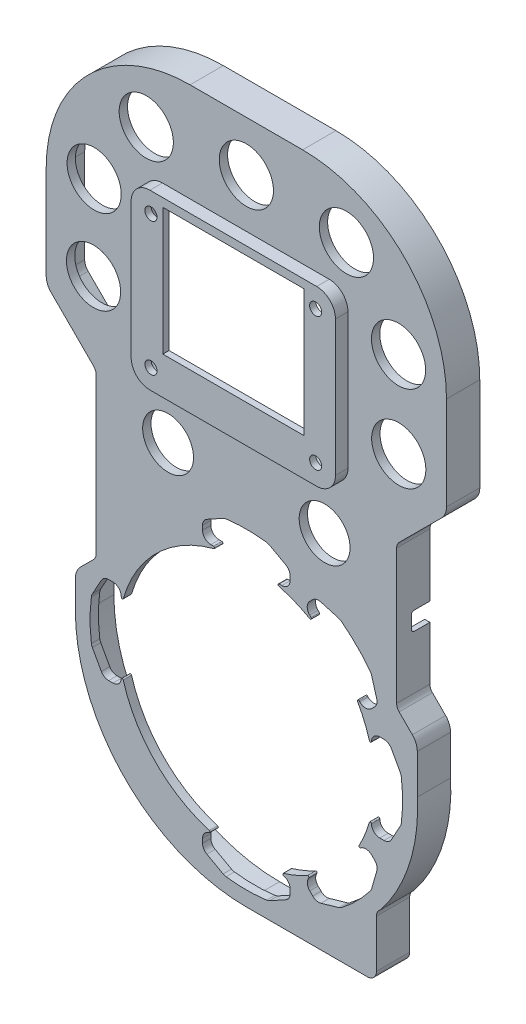
from build123d import *

# Parameters (mm, degrees)
SKETCH1_R           = 6.1
SKETCH1_R_2         = 6.5
BOSS_EXTRUDE1_DEPTH = 2
BOSS_EXTRUDE2_DEPTH = 3
CUT_EXTRUDE1_DEPTH  = 133.131994752
CUT_EXTRUDE2_DEPTH  = 3.5
CUT_EXTRUDE5_DEPTH  = 133.083738731
BOSS_EXTRUDE4_START = 5.980000305
BOSS_EXTRUDE4_DEPTH = 5.980000305
CUT_EXTRUDE4_DEPTH  = 150.092222015
FILLET1_R           = 0.25


with BuildPart() as part:
    # Sketch1 → Boss-Extrude1 (new body)
    with BuildSketch(Plane.XY):
        with BuildLine():
            Line((-40.99900221, 6.798147106), (-41.00000222, -0.001023127))
            ThreePointArc((-41.00000222, -0.001023127), (-28.991100816, -28.992114941), (-2.221e-06, -41.000999974))
            Line((-2.221e-06, -41.000999974), (28.998984813, -41.000999974))
            ThreePointArc((28.998984813, -41.000999974), (30.55486713, -40.352346624), (31.199998433, -38.795000627))
            Line((31.199998433, -38.795000627), (31.199998433, -27.309616105))
            ThreePointArc((31.199998433, -27.309616105), (31.357117283, -26.519106398), (31.805105376, -25.849107444))
            Line((31.805105376, -25.849107444), (32.299600467, -25.354612354))
            ThreePointArc((32.299600467, -25.354612354), (39.176448081, -12.31709696), (40.998998595, 2.309801221))
            Line((40.998998595, 2.309801221), (40.998998595, 11.797614815))
            ThreePointArc((40.998998595, 11.797614815), (40.689786117, 13.35390515), (39.808105495, 14.673106136))
            Line((39.808105495, 14.673106136), (36.642912795, 17.838297914))
            ThreePointArc((36.642912795, 17.838297914), (36.195116033, 18.509108816), (36.036999523, 19.299999691))
            Line((36.036999523, 19.299999691), (36.036999523, 51.57023147))
            ThreePointArc((36.036999523, 51.57023147), (36.201953979, 52.364087426), (36.652447097, 53.038233702))
            Line((36.652447097, 53.038233702), (46.818470061, 63.204256854))
            ThreePointArc((46.818470061, 63.204256854), (47.699388674, 64.523546607), (48.008999543, 66.079401409))
            Line((48.008999543, 66.079401409), (47.999999624, 88.500007865))
            ThreePointArc((47.999999624, 88.500007865), (37.895106405, 112.895106781), (13.500007489, 123))
            Line((13.500007489, 123), (-13.500000376, 123))
            ThreePointArc((-13.500000376, 123), (-37.895104377, 112.895109562), (-48.000000376, 88.500007865))
            Line((-48.000000376, 88.500007865), (-48.000000376, 66.070384522))
            ThreePointArc((-48.000000376, 66.070384522), (-47.690787898, 64.514094187), (-46.809107276, 63.1948932))
            Line((-46.809107276, 63.1948932), (-36.642914576, 53.028701423))
            ThreePointArc((-36.642914576, 53.028701423), (-36.195117814, 52.35789052), (-36.037001304, 51.566999646))
            Line((-36.037001304, 51.566999646), (-36.037000665, 14.301130179))
            ThreePointArc((-36.037000665, 14.301130179), (-36.194683873, 13.510158706), (-36.642108911, 12.839106769))
            Line((-36.642108911, 12.839106769), (-39.807845317, 9.673370264))
            ThreePointArc((-39.807845317, 9.673370264), (-40.68961653, 8.354323564), (-40.99900221, 6.798147106))
        make_face()
        with Locations((-18.767998896, 45.999999683)):
            Circle(SKETCH1_R, mode=Mode.SUBTRACT)
        with Locations((18.767988791, 45.999994761)):
            Circle(SKETCH1_R, mode=Mode.SUBTRACT)
        with Locations((36.549952387, 71.35011767)):
            Circle(SKETCH1_R_2, mode=Mode.SUBTRACT)
        with Locations((36.499964594, 92.000126825)):
            Circle(SKETCH1_R_2, mode=Mode.SUBTRACT)
        with Locations((23.9998883, 109.00006579)):
            Circle(SKETCH1_R_2, mode=Mode.SUBTRACT)
        with Locations((0.000117182, 111.000035272)):
            Circle(SKETCH1_R_2, mode=Mode.SUBTRACT)
        with Locations((-24.000058294, 108.999882684)):
            Circle(SKETCH1_R_2, mode=Mode.SUBTRACT)
        with Locations((-36.499959112, 91.999882684)):
            Circle(SKETCH1_R_2, mode=Mode.SUBTRACT)
        with Locations((-36.649960638, 71.649876581)):
            Circle(SKETCH1_R_2, mode=Mode.SUBTRACT)
        with BuildLine():
            Line((8.498217528, -29.999989932), (7.320711296, -29.999989932))
            ThreePointArc((7.320711296, -29.999989932), (11.855484749, -28.504033505), (16.103422547, -26.322960291))
            Line((16.103422547, -26.322960291), (15.206897602, -27.219485237))
            ThreePointArc((15.206897602, -27.219485237), (14.621111164, -28.633698799), (15.206897602, -30.047912361))
            Line((15.206897602, -30.047912361), (15.928049055, -30.769063814))
            ThreePointArc((15.928049055, -30.769063814), (16.84292629, -31.291513163), (17.896363573, -31.276560982))
            Line((17.896363573, -31.276560982), (22.183094016, -30.040536539))
            ThreePointArc((22.183094016, -30.040536539), (22.53156957, -29.903582275), (22.848411695, -29.704076008))
            ThreePointArc((22.848411695, -29.704076008), (26.504829459, -26.492827623), (29.714297788, -22.834847291))
            ThreePointArc((29.714297788, -22.834847291), (29.91343032, -22.518342524), (30.050164983, -22.17030134))
            Line((30.050164983, -22.17030134), (31.284907406, -17.888017149))
            ThreePointArc((31.284907406, -17.888017149), (31.299859587, -16.834579866), (30.777410238, -15.919702631))
            Line((30.777410238, -15.919702631), (30.056258785, -15.198551178))
            ThreePointArc((30.056258785, -15.198551178), (28.642045223, -14.612764741), (27.22783166, -15.198551178))
            Line((27.22783166, -15.198551178), (26.136786034, -16.289596804))
            ThreePointArc((26.136786034, -16.289596804), (28.474385236, -11.660635441), (29.999524405, -6.704265414))
            Line((29.999524405, -6.704265414), (29.999524405, -8.679270824))
            ThreePointArc((29.999524405, -8.679270824), (30.585310842, -10.093484386), (31.999524405, -10.679270824))
            Line((31.999524405, -10.679270824), (33.01938657, -10.679270824))
            ThreePointArc((33.01938657, -10.679270824), (34.035729944, -10.401782404), (34.770049802, -9.646316969))
            Line((34.770049802, -9.646316969), (36.927224702, -5.741139538))
            ThreePointArc((36.927224702, -5.741139538), (37.076792841, -5.397888822), (37.159761821, -5.032775373))
            ThreePointArc((37.159761821, -5.032775373), (37.474544109, -0.176602068), (37.157398229, 4.67941745))
            ThreePointArc((37.157398229, 4.67941745), (37.074403526, 5.044028081), (36.924987253, 5.386816369))
            Line((36.924987253, 5.386816369), (34.770049802, 9.2879433))
            ThreePointArc((34.770049802, 9.2879433), (34.035729944, 10.043408735), (33.01938657, 10.320897154))
            Line((33.01938657, 10.320897154), (31.999524405, 10.320897154))
            ThreePointArc((31.999524405, 10.320897154), (30.585310842, 9.735110716), (29.999524405, 8.320897154))
            Line((29.999524405, 8.320897154), (29.999524405, 6.332821196))
            ThreePointArc((29.999524405, 6.332821196), (28.260277654, 11.806823537), (25.53182947, 16.861054577))
            Line((25.53182947, 16.861054577), (27.202639399, 15.190244647))
            ThreePointArc((27.202639399, 15.190244647), (28.616852962, 14.60445821), (30.031066524, 15.190244647))
            Line((30.031066524, 15.190244647), (30.752217977, 15.9113961))
            ThreePointArc((30.752217977, 15.9113961), (31.274667326, 16.826273335), (31.259715145, 17.879710618))
            Line((31.259715145, 17.879710618), (30.023690702, 22.166441061))
            ThreePointArc((30.023690702, 22.166441061), (29.886736438, 22.514916616), (29.687230171, 22.83175874))
            ThreePointArc((29.687230171, 22.83175874), (26.475981786, 26.488176505), (22.818001454, 29.697644834))
            ThreePointArc((22.818001454, 29.697644834), (22.501496686, 29.896777366), (22.153455503, 30.033512029))
            Line((22.153455503, 30.033512029), (17.871171312, 31.268254451))
            ThreePointArc((17.871171312, 31.268254451), (16.817734029, 31.283206632), (15.902856794, 30.760757283))
            Line((15.902856794, 30.760757283), (15.181705341, 30.03960583))
            ThreePointArc((15.181705341, 30.03960583), (14.595918903, 28.625392268), (15.181705341, 27.211178706))
            Line((15.181705341, 27.211178706), (17.046324537, 25.346559509))
            ThreePointArc((17.046324537, 25.346559509), (11.557478813, 28.255519634), (5.59540313, 29.999976553))
            Line((5.59540313, 29.999976553), (8.493548338, 29.999976553))
            ThreePointArc((8.493548338, 29.999976553), (9.907761901, 30.585762991), (10.493548338, 31.999976553))
            Line((10.493548338, 31.999976553), (10.493548338, 33.019838718))
            ThreePointArc((10.493548338, 33.019838718), (10.216059919, 34.036182092), (9.460594484, 34.77050195))
            Line((9.460594484, 34.77050195), (5.555417053, 36.92767685))
            ThreePointArc((5.555417053, 36.92767685), (5.212166337, 37.077244989), (4.847052888, 37.16021397))
            ThreePointArc((4.847052888, 37.16021397), (-0.009120418, 37.474996257), (-4.865139935, 37.157850378))
            ThreePointArc((-4.865139935, 37.157850378), (-5.229750566, 37.074855674), (-5.572538855, 36.925439401))
            Line((-5.572538855, 36.925439401), (-9.473665785, 34.77050195))
            ThreePointArc((-9.473665785, 34.77050195), (-10.22913122, 34.036182092), (-10.506619639, 33.019838718))
            Line((-10.506619639, 33.019838718), (-10.506619639, 31.999976553))
            ThreePointArc((-10.506619639, 31.999976553), (-9.920833202, 30.585762991), (-8.506619639, 29.999976553))
            Line((-8.506619639, 29.999976553), (-5.596307426, 29.999976553))
            ThreePointArc((-5.596307426, 29.999976553), (-21.37256636, 21.853396161), (-29.999984316, 6.33486603))
            Line((-29.999984316, 6.33486603), (-29.999984316, 8.499295286))
            ThreePointArc((-29.999984316, 8.499295286), (-30.585770754, 9.913508849), (-31.999984316, 10.499295286))
            Line((-31.999984316, 10.499295286), (-33.019846482, 10.499295286))
            ThreePointArc((-33.019846482, 10.499295286), (-34.036189856, 10.221806867), (-34.770509714, 9.466341432))
            Line((-34.770509714, 9.466341432), (-36.927684614, 5.561164001))
            ThreePointArc((-36.927684614, 5.561164001), (-37.077252753, 5.217913285), (-37.160221733, 4.852799836))
            ThreePointArc((-37.160221733, 4.852799836), (-37.47500402, -0.00337347), (-37.157858141, -4.859392987))
            ThreePointArc((-37.157858141, -4.859392987), (-37.074863438, -5.224003618), (-36.925447164, -5.566791907))
            Line((-36.925447164, -5.566791907), (-34.770509714, -9.467918837))
            ThreePointArc((-34.770509714, -9.467918837), (-34.036189856, -10.223384272), (-33.019846482, -10.500872691))
            Line((-33.019846482, -10.500872691), (-31.999984316, -10.500872691))
            ThreePointArc((-31.999984316, -10.500872691), (-30.585770754, -9.915086254), (-29.999984316, -8.500872691))
            Line((-29.999984316, -8.500872691), (-29.999984316, -6.706310248))
            ThreePointArc((-29.999984316, -6.706310248), (-21.997212331, -21.601429929), (-7.321615592, -29.999989932))
            Line((-7.321615592, -29.999989932), (-8.50195045, -29.999989932))
            ThreePointArc((-8.50195045, -29.999989932), (-9.916164012, -30.58577637), (-10.50195045, -31.999989932))
            Line((-10.50195045, -31.999989932), (-10.50195045, -33.019852097))
            ThreePointArc((-10.50195045, -33.019852097), (-10.224462031, -34.036195472), (-9.468996596, -34.770515329))
            Line((-9.468996596, -34.770515329), (-5.563819165, -36.92769023))
            ThreePointArc((-5.563819165, -36.92769023), (-5.220568448, -37.077258368), (-4.855454999, -37.160227349))
            ThreePointArc((-4.855454999, -37.160227349), (0.000718306, -37.475009636), (4.856737824, -37.157863757))
            ThreePointArc((4.856737824, -37.157863757), (5.221348455, -37.074869053), (5.564136743, -36.92545278))
            Line((5.564136743, -36.92545278), (9.465263674, -34.770515329))
            ThreePointArc((9.465263674, -34.770515329), (10.220729109, -34.036195472), (10.498217528, -33.019852097))
            Line((10.498217528, -33.019852097), (10.498217528, -31.999989932))
            ThreePointArc((10.498217528, -31.999989932), (9.91243109, -30.58577637), (8.498217528, -29.999989932))
        make_face(mode=Mode.SUBTRACT)
    extrude(amount=BOSS_EXTRUDE1_DEPTH)

    # Sketch3 → Boss-Extrude2 (add)
    with BuildSketch(Plane.XY.offset(2)):
        with BuildLine():
            Line((-17.027010773, 99.303991329), (-20.127010773, 99.303990787))
            ThreePointArc((-20.127010773, 99.303990787), (-23.308991058, 97.985970746), (-24.627009986, 94.803990001))
            Line((-24.627009986, 94.803990001), (-24.627004304, 62.303990001))
            ThreePointArc((-24.627004304, 62.303990001), (-23.308984263, 59.122009716), (-20.127003517, 57.803990787))
            Line((-20.127003517, 57.803990787), (-17.027003517, 57.803991329))
            Line((-17.027003517, 57.803991329), (16.772996424, 57.803997239))
            Line((16.772996424, 57.803997239), (19.872996483, 57.803997781))
            ThreePointArc((19.872996483, 57.803997781), (23.054976768, 59.122017822), (24.372995696, 62.303998568))
            Line((24.372995696, 62.303998568), (24.372990014, 94.803998568))
            ThreePointArc((24.372990014, 94.803998568), (23.054969973, 97.985978853), (19.872989227, 99.303997781))
            Line((19.872989227, 99.303997781), (16.772989155, 99.303997239))
            Line((16.772989155, 99.303997239), (-17.027010773, 99.303991329))
        make_face()
    extrude(amount=BOSS_EXTRUDE2_DEPTH)

    # Sketch4 → Cut-Extrude1 (cut, through all)
    with BuildSketch(Plane.XY.offset(5)):
        Polygon((-17.027005163, 66.803991329), (16.772994837, 66.803997239), (16.772989505, 97.303997239), (-17.027010495, 97.303991329), align=None)
    extrude(amount=-CUT_EXTRUDE1_DEPTH, mode=Mode.SUBTRACT)

    # Sketch5 → Cut-Extrude2 (cut)
    with BuildSketch(Plane.XY):
        with BuildLine():
            Line((-22.877009986, 94.803990307), (-22.877004304, 62.303990307))
            ThreePointArc((-22.877004304, 62.303990307), (-22.071547612, 60.359446799), (-20.127003823, 59.553990787))
            Line((-20.127003823, 59.553990787), (-17.027003823, 59.553991329))
            Line((-17.027003823, 59.553991329), (16.772996118, 59.553997239))
            Line((16.772996118, 59.553997239), (19.872996177, 59.553997781))
            ThreePointArc((19.872996177, 59.553997781), (21.817539685, 60.359454473), (22.622995696, 62.303998262))
            Line((22.622995696, 62.303998262), (22.622990014, 94.803998262))
            ThreePointArc((22.622990014, 94.803998262), (21.817533322, 96.748541769), (19.872989533, 97.553997781))
            Line((19.872989533, 97.553997781), (16.772989461, 97.553997239))
            Line((16.772989461, 97.553997239), (-17.027010539, 97.553991329))
            Line((-17.027010539, 97.553991329), (-20.127010467, 97.553990787))
            ThreePointArc((-20.127010467, 97.553990787), (-22.071553974, 96.748534096), (-22.877009986, 94.803990307))
        make_face()
    extrude(amount=CUT_EXTRUDE2_DEPTH, mode=Mode.SUBTRACT)

    # Sketch8 → Cut-Extrude5 (cut, through all)
    with BuildSketch(Plane(origin=(0, 0, 3.5), x_dir=(-1, 0, 0), z_dir=(0, 0, -1))):
        with BuildLine():
            add(Edge.make_bspline(
                [(21.327009938, 94.528990578), (21.327010445, 97.428990578), (18.427010445, 97.428991085), (18.427009938, 94.528991085), (18.427009431, 91.628991085), (21.327009431, 91.628990578), (21.327009938, 94.528990578)],
                knots=[0, 0, 0, 0, 0.5, 0.5, 0.5, 1, 1, 1, 1], degree=3, weights=[1, 0.333333333, 0.333333333, 1, 0.333333333, 0.333333333, 1]))
        make_face()
        with BuildLine():
            add(Edge.make_bspline(
                [(21.327004352, 62.578990578), (21.327004859, 65.478990578), (18.427004859, 65.478991085), (18.427004352, 62.578991085), (18.427003845, 59.678991085), (21.327003845, 59.678990578), (21.327004352, 62.578990578)],
                knots=[0, 0, 0, 0, 0.5, 0.5, 0.5, 1, 1, 1, 1], degree=3, weights=[1, 0.333333333, 0.333333333, 1, 0.333333333, 0.333333333, 1]))
        make_face()
        with BuildLine():
            add(Edge.make_bspline(
                [(-18.172995648, 62.578997484), (-18.172995141, 65.478997484), (-21.072995141, 65.478997991), (-21.072995648, 62.578997991), (-21.072996155, 59.678997991), (-18.172996155, 59.678997484), (-18.172995648, 62.578997484)],
                knots=[0, 0, 0, 0, 0.5, 0.5, 0.5, 1, 1, 1, 1], degree=3, weights=[1, 0.333333333, 0.333333333, 1, 0.333333333, 0.333333333, 1]))
        make_face()
        with BuildLine():
            add(Edge.make_bspline(
                [(-18.172990062, 94.528997484), (-18.172989555, 97.428997484), (-21.072989555, 97.428997991), (-21.072990062, 94.528997991), (-21.072990569, 91.628997991), (-18.172990569, 91.628997484), (-18.172990062, 94.528997484)],
                knots=[0, 0, 0, 0, 0.5, 0.5, 0.5, 1, 1, 1, 1], degree=3, weights=[1, 0.333333333, 0.333333333, 1, 0.333333333, 0.333333333, 1]))
        make_face()
    extrude(amount=-CUT_EXTRUDE5_DEPTH, mode=Mode.SUBTRACT)

    # Sketch9 → Boss-Extrude4 (add)
    with BuildSketch(Plane(origin=(0, 0, 0), x_dir=(-1, 0, 0), z_dir=(0, 0, -1)).offset(BOSS_EXTRUDE4_START)):
        with BuildLine():
            Line((41.00000222, -0.001023127), (40.99900221, 6.798147106))
            ThreePointArc((40.99900221, 6.798147106), (40.68961653, 8.354323564), (39.807845317, 9.673370264))
            Line((39.807845317, 9.673370264), (36.642108911, 12.839106769))
            ThreePointArc((36.642108911, 12.839106769), (36.194683873, 13.510158706), (36.037000665, 14.301130179))
            Line((36.037000665, 14.301130179), (36.037001304, 51.566999646))
            ThreePointArc((36.037001304, 51.566999646), (36.195117814, 52.35789052), (36.642914576, 53.028701423))
            Line((36.642914576, 53.028701423), (46.809107276, 63.1948932))
            ThreePointArc((46.809107276, 63.1948932), (47.690787898, 64.514094187), (48.000000376, 66.070384522))
            Line((48.000000376, 66.070384522), (48.000000376, 88.500007865))
            ThreePointArc((48.000000376, 88.500007865), (37.895104377, 112.895109562), (13.500000376, 123))
            Line((13.500000376, 123), (-13.500007489, 123))
            ThreePointArc((-13.500007489, 123), (-37.895106405, 112.895106781), (-47.999999624, 88.500007865))
            Line((-47.999999624, 88.500007865), (-48.008999543, 66.079401409))
            ThreePointArc((-48.008999543, 66.079401409), (-47.699388674, 64.523546607), (-46.818470061, 63.204256854))
            Line((-46.818470061, 63.204256854), (-36.652447097, 53.038233702))
            ThreePointArc((-36.652447097, 53.038233702), (-36.201953979, 52.364087426), (-36.036999523, 51.57023147))
            Line((-36.036999523, 51.57023147), (-36.036999523, 19.299999691))
            ThreePointArc((-36.036999523, 19.299999691), (-36.195116033, 18.509108816), (-36.642912795, 17.838297914))
            Line((-36.642912795, 17.838297914), (-39.808105495, 14.673106136))
            ThreePointArc((-39.808105495, 14.673106136), (-40.689786117, 13.35390515), (-40.998998595, 11.797614815))
            Line((-40.998998595, 11.797614815), (-40.998998595, 2.309801221))
            ThreePointArc((-40.998998595, 2.309801221), (-39.176448081, -12.31709696), (-32.299600467, -25.354612354))
            Line((-32.299600467, -25.354612354), (-31.805105376, -25.849107444))
            ThreePointArc((-31.805105376, -25.849107444), (-31.357117283, -26.519106398), (-31.199998433, -27.309616105))
            Line((-31.199998433, -27.309616105), (-31.199998433, -38.795000627))
            ThreePointArc((-31.199998433, -38.795000627), (-30.55486713, -40.352346624), (-28.998984813, -41.000999974))
            Line((-28.998984813, -41.000999974), (2.221e-06, -41.000999974))
            ThreePointArc((2.221e-06, -41.000999974), (28.991100816, -28.992114941), (41.00000222, -0.001023127))
        make_face()
        with BuildLine():
            Line((-46.749999674, 88.499752066), (-46.758999618, 66.079325803))
            ThreePointArc((-46.758999618, 66.079325803), (-46.544463425, 65.001717319), (-45.934359207, 64.087912836))
            Line((-45.934359207, 64.087912836), (-35.766922921, 53.92047648))
            ThreePointArc((-35.766922921, 53.92047648), (-35.048011138, 52.844630382), (-34.786999523, 51.577289893))
            Line((-34.786999523, 51.577289893), (-34.7870004, 19.298952495))
            ThreePointArc((-34.7870004, 19.298952495), (-35.040330706, 18.03060068), (-35.75852482, 16.954919512))
            Line((-35.75852482, 16.954919512), (-38.924346277, 13.789098436))
            ThreePointArc((-38.924346277, 13.789098436), (-39.534924364, 12.875580722), (-39.748998641, 11.797855141))
            Line((-39.748998641, 11.797855141), (-39.748998595, 2.274052241))
            ThreePointArc((-39.748998595, 2.274052241), (-38.000371489, -11.889986409), (-31.362515096, -24.523930772))
            Line((-31.362515096, -24.523930772), (-30.921466517, -24.964979486))
            ThreePointArc((-30.921466517, -24.964979486), (-30.202288092, -26.040703378), (-29.949998479, -27.309856431))
            Line((-29.949998479, -27.309856431), (-29.949998879, -38.794254182))
            ThreePointArc((-29.949998879, -38.794254182), (-29.670327179, -39.469120846), (-28.996379836, -39.750999974))
            Line((-28.996379836, -39.750999974), (-1.1897e-05, -39.750999975))
            ThreePointArc((-1.1897e-05, -39.750999975), (28.107184964, -28.10826384), (39.750002227, -0.00110058))
            Line((39.750002227, -0.00110058), (39.749002237, 6.798213738))
            ThreePointArc((39.749002237, 6.798213738), (39.534798994, 7.875892477), (38.92412658, 8.78932211))
            Line((38.92412658, 8.78932211), (35.757477844, 11.95597215))
            ThreePointArc((35.757477844, 11.95597215), (35.03976749, 13.031966948), (34.787001064, 14.300423607))
            Line((34.787001064, 14.300423607), (34.787002181, 51.568046852))
            ThreePointArc((34.787002181, 51.568046852), (35.040332477, 52.836398633), (35.758526557, 53.91207978))
            Line((35.758526557, 53.91207978), (45.925348014, 64.078900856))
            ThreePointArc((45.925348014, 64.078900856), (46.535926133, 64.992418586), (46.750000422, 66.070144196))
            Line((46.750000422, 66.070144196), (46.750000376, 88.500007865))
            ThreePointArc((46.750000376, 88.500007865), (37.011217525, 112.01122946), (13.49999083, 121.75))
            Line((13.49999083, 121.75), (-13.499997658, 121.75))
            ThreePointArc((-13.499997658, 121.75), (-37.011309891, 112.011136342), (-46.749999674, 88.499752066))
        make_face(mode=Mode.SUBTRACT)
    extrude(amount=-BOSS_EXTRUDE4_DEPTH)

    # Sketch10 → Cut-Extrude4 (cut, through all)
    with BuildSketch(Plane(origin=(-36.037000419, -6.18e-07, 0), x_dir=(0, 0, 1), z_dir=(-0.9999999999999999, -1.7148385825707833e-08, 0))):
        with BuildLine():
            Line((-5.230000305, 36.549993091), (-2.230000305, 36.549993088))
            ThreePointArc((-2.230000305, 36.549993088), (-1.962121906, 36.496708764), (-1.735025561, 36.344967847))
            ThreePointArc((-1.735025561, 36.344967847), (-1.583284636, 36.117871501), (-1.530000295, 35.849993102))
            Line((-1.530000295, 35.849993102), (-1.530000305, 32.849993091))
            ThreePointArc((-1.530000305, 32.849993091), (-1.583284631, 32.582114691), (-1.735025545, 32.355018344))
            ThreePointArc((-1.735025545, 32.355018344), (-1.962121899, 32.203277418), (-2.230000305, 32.149993088))
            Line((-2.230000305, 32.149993088), (-5.230000305, 32.149993091))
            Line((-5.230000305, 32.149993091), (-5.980000305, 32.149993091))
            Line((-5.980000305, 32.149993091), (-5.980000305, 36.549993091))
            Line((-5.980000305, 36.549993091), (-5.230000305, 36.549993091))
        make_face()
    extrude(amount=-CUT_EXTRUDE4_DEPTH, mode=Mode.SUBTRACT)

    # Fillet1
    fillet1_edges = [part.edges().sort_by_distance(p)[0] for p in [
        (5.59540313, 29.999976553, 1),
        (-5.596307426, 29.999976553, 1),
        (-29.999984316, 6.33486603, 1),
        (-29.999984316, -6.706310248, 1),
        (-7.321615592, -29.999989932, 1),
        (7.320711296, -29.999989932, 1),
        (16.103422547, -26.322960291, 1),
        (26.136786034, -16.289596804, 1),
        (29.999524405, -6.704265414, 1),
        (29.999524405, 6.332821196, 1),
        (25.53182947, 16.861054577, 1),
        (17.046324537, 25.346559509, 1),
    ]]
    fillet(fillet1_edges, radius=FILLET1_R)


solid = part.part
